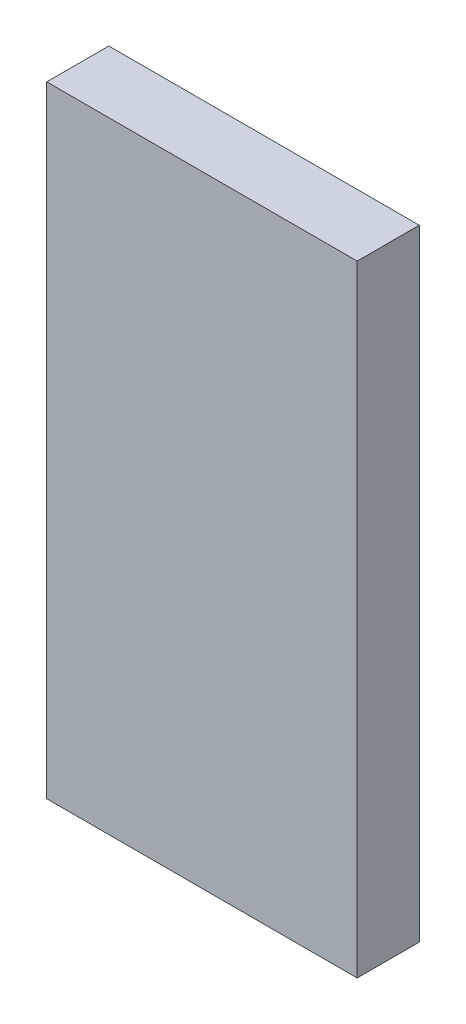
from build123d import *

# Parameters (mm, degrees)
SKETCH_1_W      = 60
SKETCH_1_H      = 120
EXTRUDE_1_DEPTH = 12


with BuildPart() as part:
    # 草圖1 → 填料-伸長1 (new body)
    with BuildSketch(Plane.XY):
        with Locations((30, 60)):
            Rectangle(SKETCH_1_W, SKETCH_1_H)
    extrude(amount=EXTRUDE_1_DEPTH)


solid = part.part
